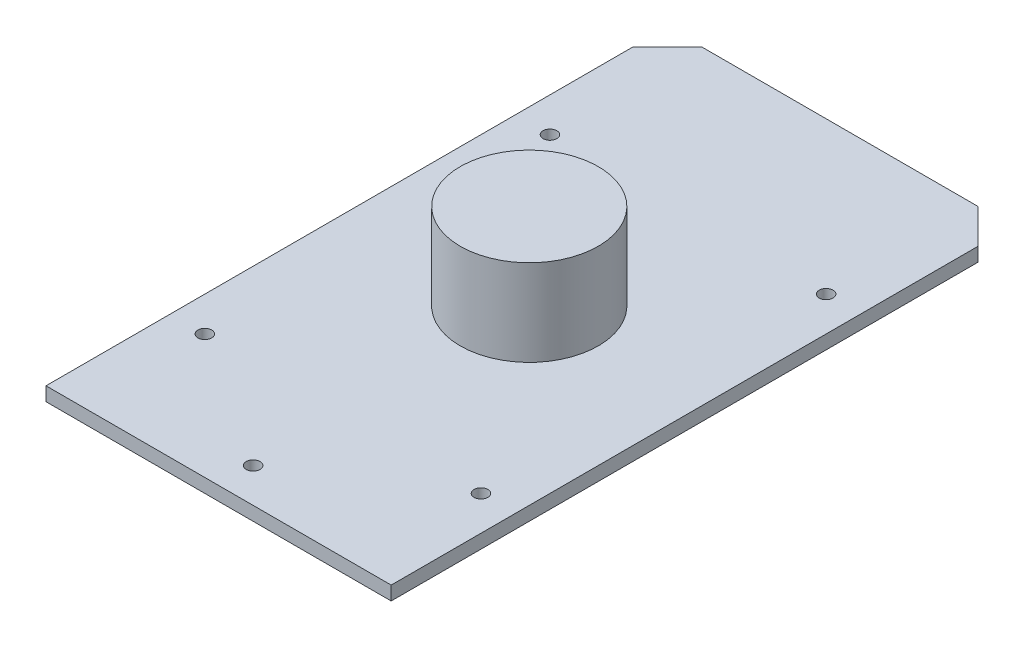
from build123d import *

# Parameters (mm, degrees)
SKETCH1_W           = 500
SKETCH1_H           = 900
BOSS_EXTRUDE1_DEPTH = 20
CHAMFER1_SIZE       = 50
SKETCH2_R           = 10
CUT_EXTRUDE1_DEPTH  = 516.169874896
SKETCH3_R           = 100
BOSS_EXTRUDE2_DEPTH = 125
SKETCH4_R           = 10
CUT_EXTRUDE2_DEPTH  = 530.74050251


with BuildPart() as part:
    # Sketch1 → Boss-Extrude1 (new body)
    with BuildSketch(Plane(origin=(0, 0, 0), x_dir=(1, 0, 0), z_dir=(0, 1, 0))):
        Rectangle(SKETCH1_W, SKETCH1_H)
    extrude(amount=BOSS_EXTRUDE1_DEPTH)

    # Chamfer1
    chamfer1_edges = [part.edges().sort_by_distance(p)[0] for p in [
        (-250, 10, -450),
        (250, 10, -450),
    ]]
    chamfer(chamfer1_edges, length=CHAMFER1_SIZE)

    # Sketch2 → Cut-Extrude1 (cut, through all)
    with BuildSketch(Plane(origin=(0, 20, 0), x_dir=(1, 0, 0), z_dir=(0, 1, 0))):
        with Locations(Location((200, 230, 0), (0, 0, 270))):
            Circle(SKETCH2_R)
        with Locations(Location((-200, 230, 0), (0, 0, 270))):
            Circle(SKETCH2_R)
        with Locations(Location((200, -270, 0), (0, 0, 270))):
            Circle(SKETCH2_R)
        with Locations(Location((-200, -270, 0), (0, 0, 270))):
            Circle(SKETCH2_R)
    extrude(amount=-CUT_EXTRUDE1_DEPTH, mode=Mode.SUBTRACT)

    # Sketch3 → Boss-Extrude2 (add)
    with BuildSketch(Plane(origin=(0, 20, 0), x_dir=(1, 0, 0), z_dir=(0, 1, 0))):
        with Locations(Location((0, 0, 0), (0, 0, 270))):
            Circle(SKETCH3_R)
    extrude(amount=BOSS_EXTRUDE2_DEPTH)

    # Sketch4 → Cut-Extrude2 (cut, through all)
    with BuildSketch(Plane(origin=(0, 20, 0), x_dir=(1, 0, 0), z_dir=(0, 1, 0))):
        with Locations(Location((0, -400, 0), (0, 0, 270))):
            Circle(SKETCH4_R)
    extrude(amount=-CUT_EXTRUDE2_DEPTH, mode=Mode.SUBTRACT)


solid = part.part
